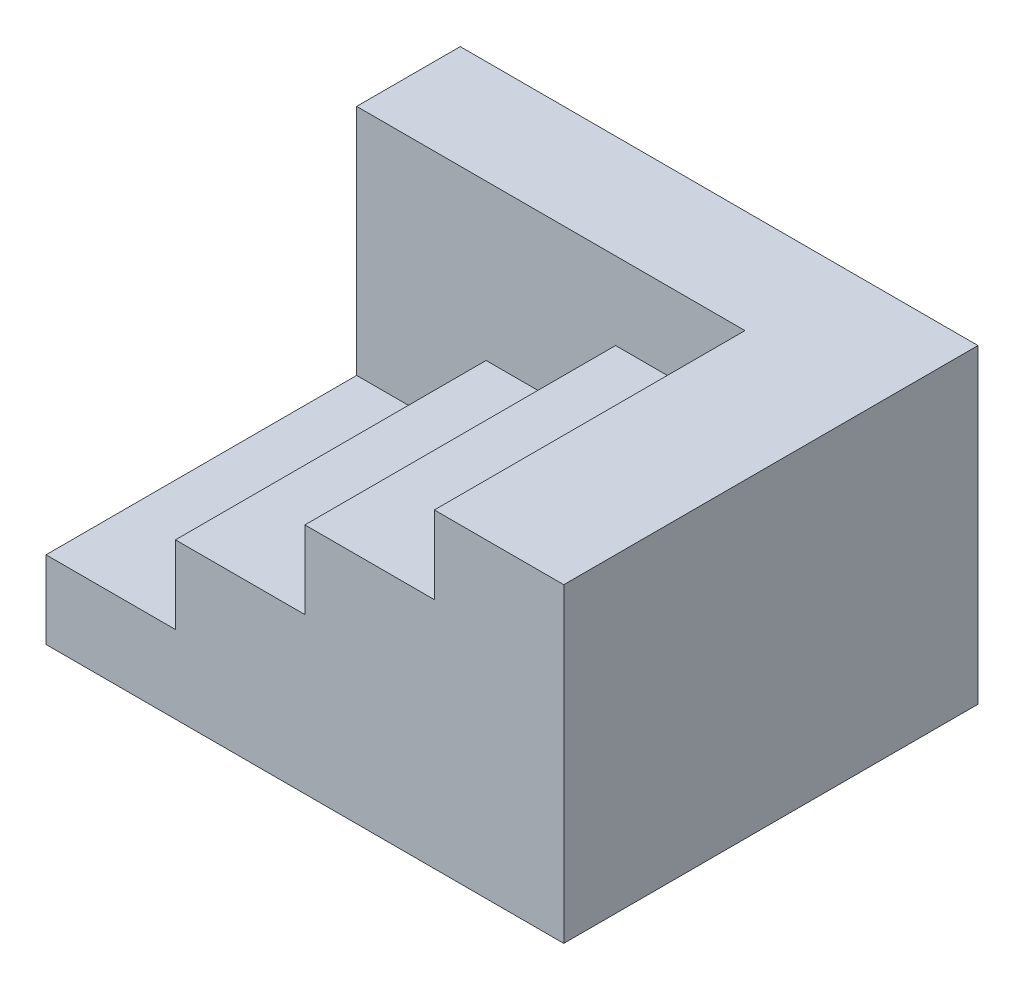
from build123d import *

# Parameters (mm, degrees)
SKETCH1_W           = 100
SKETCH1_H           = 80
BOSS_EXTRUDE1_DEPTH = 60
CUT_EXTRUDE1_DEPTH  = 60


with BuildPart() as part:
    # Sketch1 → Boss-Extrude1 (new body)
    with BuildSketch(Plane(origin=(0, 0, 0), x_dir=(1, 0, 0), z_dir=(0, 1, 0))):
        with Locations((50, 40)):
            Rectangle(SKETCH1_W, SKETCH1_H)
    extrude(amount=BOSS_EXTRUDE1_DEPTH)

    # Sketch3 → Cut-Extrude1 (cut)
    with BuildSketch(Plane.XY):
        Polygon((0, 60), (75, 60), (75, 45), (50, 45), (50, 30), (25, 30), (25, 15), (0, 15), align=None)
    extrude(amount=-CUT_EXTRUDE1_DEPTH, mode=Mode.SUBTRACT)


solid = part.part
